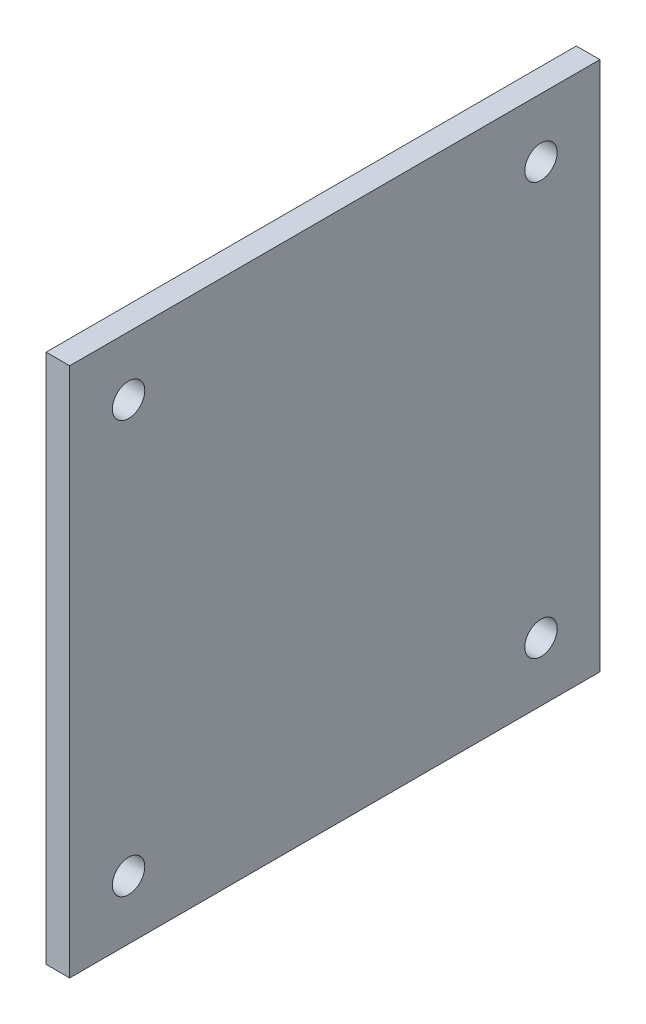
from build123d import *

# Parameters (mm, degrees)
PLATE_START     = -37.6
PLATE_SKETCH_W  = 36
PLATE_SKETCH_H  = 36
PLATE_SKETCH_R  = 1.1
PLATE_DEPTH     = 1.6
BNO085_START    = -39.2
BNO085_SKETCH_W = 22.7
BNO085_SKETCH_H = 25.6
BNO085_DEPTH    = 4.6


with BuildPart() as part:
    # Plate Sketch → Plate (new body)
    with BuildSketch(Plane(origin=(0, 0, 0), x_dir=(0, 0, -1), z_dir=(1, 0, 0)).offset(PLATE_START)):
        Rectangle(PLATE_SKETCH_W, PLATE_SKETCH_H)
        with Locations((14, -14)):
            Circle(PLATE_SKETCH_R, mode=Mode.SUBTRACT)
        with Locations((-14, -14)):
            Circle(PLATE_SKETCH_R, mode=Mode.SUBTRACT)
        with Locations((14, 14)):
            Circle(PLATE_SKETCH_R, mode=Mode.SUBTRACT)
        with Locations((-14, 14)):
            Circle(PLATE_SKETCH_R, mode=Mode.SUBTRACT)
    extrude(amount=-PLATE_DEPTH)

    # BNO085 Sketch → BNO085 (add)
    with BuildSketch(Plane(origin=(0, 0, 0), x_dir=(0, 0, -1), z_dir=(1, 0, 0)).offset(BNO085_START)):
        Rectangle(BNO085_SKETCH_W, BNO085_SKETCH_H)
    extrude(amount=-BNO085_DEPTH)


solid = part.part
